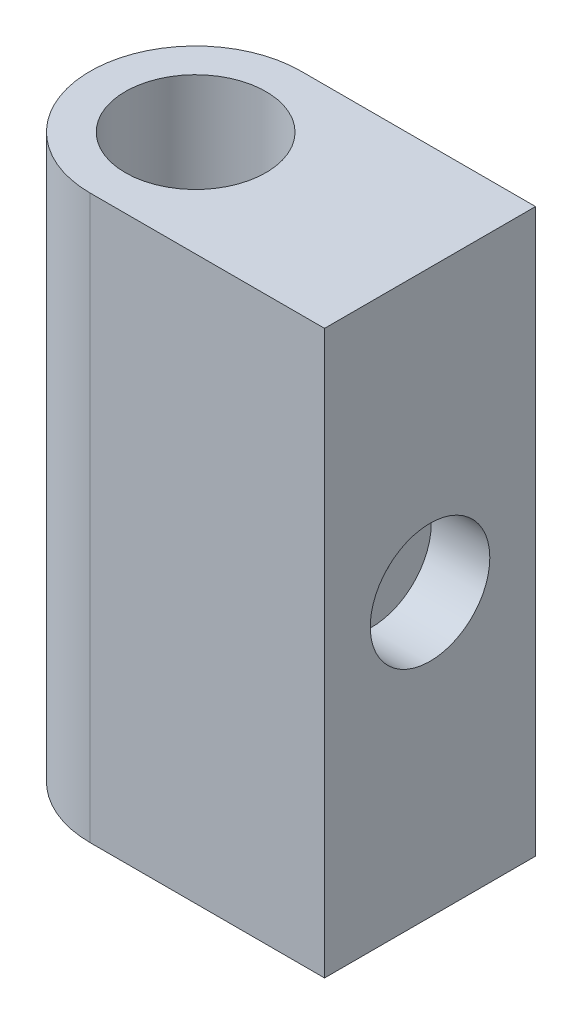
from build123d import *

# Parameters (mm, degrees)
BOSS_EXTRUDE1_DEPTH = 24
CUT_EXTRUDE1_DEPTH  = 2.5
SKETCH3_R           = 1
CUT_EXTRUDE3_DEPTH  = 8.5
CUT_EXTRUDE4_START  = 5
SKETCH4_R           = 2.55
CUT_EXTRUDE4_DEPTH  = 5
SKETCH5_R           = 2.55
CUT_EXTRUDE5_DEPTH  = 10


with BuildPart() as part:
    # Sketch1 → Boss-Extrude1 (new body)
    with BuildSketch(Plane(origin=(0, 0, 0), x_dir=(1, 0, 0), z_dir=(0, 1, 0))):
        with BuildLine():
            ThreePointArc((0, -3), (-3, 0), (0, 3))
            Line((0, 3), (0, 4.5))
            ThreePointArc((0, 4.5), (-4.5, 0), (0, -4.5))
            Line((0, -4.5), (0, -3))
        make_face()
        with BuildLine():
            Line((0, 4.5), (0, 3))
            ThreePointArc((0, 3), (2.121320344, 2.121320344), (3, 0))
            ThreePointArc((3, 0), (2.121320344, -2.121320344), (0, -3))
            Line((0, -3), (0, -4.5))
            ThreePointArc((0, -4.5), (3.181980515, -3.181980515), (4.5, 0))
            ThreePointArc((4.5, 0), (3.181980515, 3.181980515), (0, 4.5))
        make_face()
        with BuildLine():
            Line((10, 4.5), (0, 4.5))
            ThreePointArc((0, 4.5), (3.181980515, 3.181980515), (4.5, 0))
            ThreePointArc((4.5, 0), (3.181980515, -3.181980515), (0, -4.5))
            Line((0, -4.5), (10, -4.5))
            Line((10, -4.5), (10, 4.5))
        make_face()
    extrude(amount=BOSS_EXTRUDE1_DEPTH)

    # Sketch2 → Cut-Extrude1 (cut)
    with BuildSketch(Plane(origin=(10, 0, 0), x_dir=(0, 0, -1), z_dir=(1, 0, 0))):
        with BuildLine():
            ThreePointArc((2.55, 12), (1.803122292, 13.803122292), (0, 14.55))
            Line((0, 14.55), (0, 9.45))
            ThreePointArc((0, 9.45), (1.803122292, 10.196877708), (2.55, 12))
        make_face()
        with BuildLine():
            Line((0, 9.45), (0, 14.55))
            ThreePointArc((0, 14.55), (-2.55, 12), (0, 9.45))
        make_face()
    extrude(amount=-CUT_EXTRUDE1_DEPTH, mode=Mode.SUBTRACT)

    # Sketch3 → Cut-Extrude3 (cut)
    with BuildSketch(Plane(origin=(7.5, 0, 0), x_dir=(0, 0, -1), z_dir=(1, 0, 0))):
        with Locations((0, 12)):
            Circle(SKETCH3_R)
    extrude(amount=-CUT_EXTRUDE3_DEPTH, mode=Mode.SUBTRACT)

    # Sketch4 → Cut-Extrude4 (cut)
    with BuildSketch(Plane(origin=(0.5, 0, 0), x_dir=(0, 0, -1), z_dir=(1, 0, 0)).offset(CUT_EXTRUDE4_START)):
        with Locations((0, 12)):
            Circle(SKETCH4_R)
    extrude(amount=-CUT_EXTRUDE4_DEPTH, mode=Mode.SUBTRACT)

    # Sketch5 → Cut-Extrude5 (cut)
    with BuildSketch(Plane(origin=(0.5, 0, 0), x_dir=(0, 0, -1), z_dir=(1, 0, 0))):
        with Locations((0, 12)):
            Circle(SKETCH5_R)
    extrude(amount=-CUT_EXTRUDE5_DEPTH, mode=Mode.SUBTRACT)


solid = part.part
